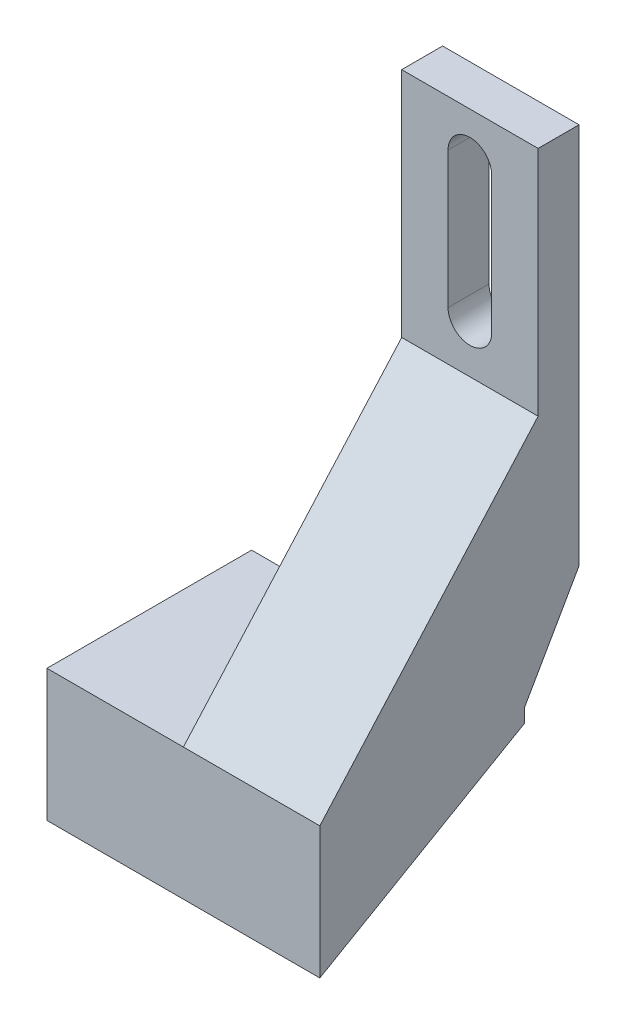
from build123d import *

# Parameters (mm, degrees)
SKETCH1_W           = 10
SKETCH1_H           = 25
BOSS_EXTRUDE1_DEPTH = 3
SKETCH3_W           = 3
SKETCH3_H           = 7
BOSS_EXTRUDE2_DEPTH = 10
BOSS_EXTRUDE3_DEPTH = 20
BOSS_EXTRUDE4_DEPTH = 10


with BuildPart() as part:
    # Sketch1 → Boss-Extrude1 (new body)
    with BuildSketch(Plane.XY):
        with Locations((0, 22.5)):
            Rectangle(SKETCH1_W, SKETCH1_H)
        with BuildLine():
            ThreePointArc((-1.6, 31.6), (0, 33.2), (1.6, 31.6))
            Line((1.6, 31.6), (1.6, 21.6))
            ThreePointArc((1.6, 21.6), (0, 20), (-1.6, 21.6))
            Line((-1.6, 21.6), (-1.6, 31.6))
        make_face(mode=Mode.SUBTRACT)
    extrude(amount=BOSS_EXTRUDE1_DEPTH)

    # Sketch3 → Boss-Extrude2 (add)
    with BuildSketch(Plane(origin=(5, 0, 0), x_dir=(0, 0, -1), z_dir=(1, 0, 0))):
        Polygon((0, 7), (0, 10), (-3, 10), (-7, 10), (-7, 7), (-4, 7), align=None)
        with Locations((-5.5, 3.5)):
            Rectangle(SKETCH3_W, SKETCH3_H)
    extrude(amount=-BOSS_EXTRUDE2_DEPTH)

    # Sketch4 → Boss-Extrude3 (add)
    with BuildSketch(Plane(origin=(5, 0, 0), x_dir=(0, 0, -1), z_dir=(1, 0, 0))):
        Polygon((-19, -9.660254038), (-4, 0), (-7, 0), (-19, 0), align=None)
        Polygon((-4, -1), (-19, -9.660254038), (-4, 0), align=None)
    extrude(amount=-BOSS_EXTRUDE3_DEPTH)

    # Sketch5 → Boss-Extrude4 (add)
    with BuildSketch(Plane.ZY.offset(5)):
        Polygon((4, 7), (0, 7), (4, 0), align=None)
        Polygon((3, 18), (0, 7), (4, 7), (4, 0), (19, 0), (9.027600975, 11.218948904), align=None)
    extrude(amount=-BOSS_EXTRUDE4_DEPTH)


solid = part.part
